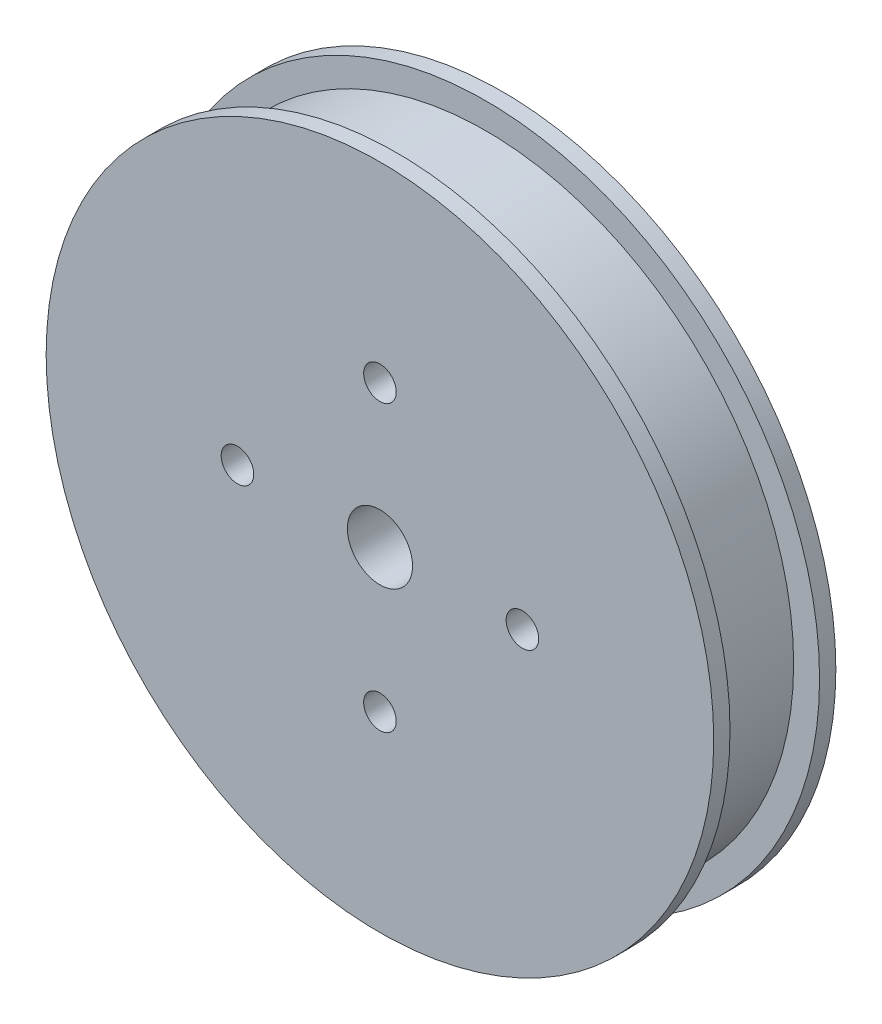
from build123d import *

# Parameters (mm, degrees)
SKETCH_1_R          = 41
SKETCH_1_R_2        = 4
SKETCH_1_R_3        = 2
EXTRUDE_1_DEPTH     = 15
CUT_EXTRUDE_START   = -13
SKETCH_3_R          = 41
SKETCH_3_R_2        = 37.815
CUT_EXTRUDE_1_DEPTH = 11


with BuildPart() as part:
    # 草图1 → 凸台-拉伸1 (new body)
    with BuildSketch(Plane.XY):
        Circle(SKETCH_1_R)
        Circle(SKETCH_1_R_2, mode=Mode.SUBTRACT)
        with Locations((-17.5, 0)):
            Circle(SKETCH_1_R_3, mode=Mode.SUBTRACT)
        with Locations((0, 17.5)):
            Circle(SKETCH_1_R_3, mode=Mode.SUBTRACT)
        with Locations((17.5, 0)):
            Circle(SKETCH_1_R_3, mode=Mode.SUBTRACT)
        with Locations((0, -17.5)):
            Circle(SKETCH_1_R_3, mode=Mode.SUBTRACT)
    extrude(amount=EXTRUDE_1_DEPTH)

    # 草图3 → 切除-拉伸1 (cut)
    with BuildSketch(Plane.XY.offset(15).offset(CUT_EXTRUDE_START)):
        Circle(SKETCH_3_R)
        Circle(SKETCH_3_R_2, mode=Mode.SUBTRACT)
    extrude(amount=CUT_EXTRUDE_1_DEPTH, mode=Mode.SUBTRACT)


solid = part.part
